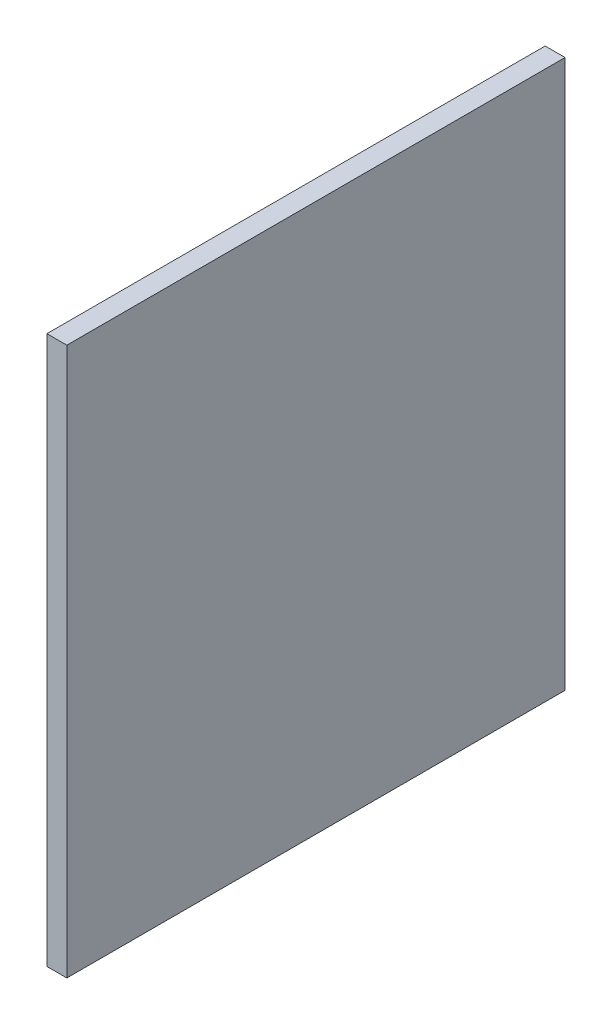
from build123d import *

# Parameters (mm, degrees)
SKETCH1_W           = 50
SKETCH1_H           = 55
BOSS_EXTRUDE1_DEPTH = 2


with BuildPart() as part:
    # Sketch1 → Boss-Extrude1 (new body)
    with BuildSketch(Plane(origin=(0, 0, 0), x_dir=(0, 0, -1), z_dir=(1, 0, 0))):
        Rectangle(SKETCH1_W, SKETCH1_H)
    extrude(amount=BOSS_EXTRUDE1_DEPTH)


solid = part.part
